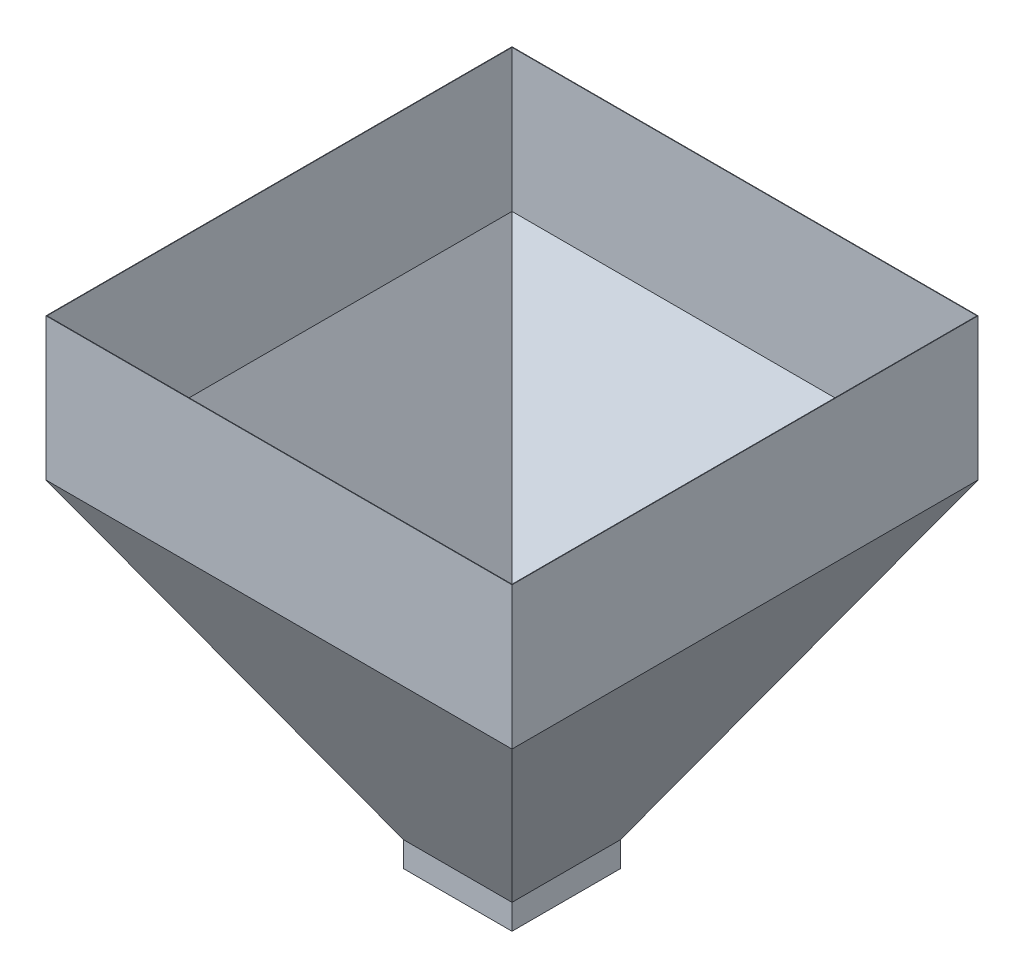
from build123d import *

# Parameters (mm, degrees)
CROQUIS3_W              = 688
CROQUIS3_H              = 688
SALIENTE_EXTRUIR1_DEPTH = 210
VACIADO2_T              = -0.76
CROQUIS4_W              = 160
CROQUIS4_H              = 160
CROQUIS4_W_2            = 158.247461632
CROQUIS4_H_2            = 158.247461632
SALIENTE_EXTRUIR2_DEPTH = 37


with BuildPart() as part:
    # Croquis1 → Recubrir1 section 0
    with BuildSketch(Plane(origin=(0, 0, 0), x_dir=(1, 0, 0), z_dir=(0, 1, 0))):
        with BuildLine():
            Line((-344, 344), (344, 344))
            Line((344, 344), (344, -344))
            Line((344, -344), (-344, -344))
            Line((-344, -344), (-344, 344))
        make_face()
    # Croquis2 → Recubrir1 section 1
    with BuildSketch(Plane(origin=(0, -460, 0), x_dir=(1, 0, 0), z_dir=(0, 1, 0))):
        with BuildLine():
            Line((-80, 80), (80, 80))
            Line((80, 80), (80, -80))
            Line((80, -80), (-80, -80))
            Line((-80, -80), (-80, 80))
        make_face()
    loft()

    # Croquis3 → Saliente-Extruir1 (add)
    with BuildSketch(Plane(origin=(0, 0, 0), x_dir=(1, 0, 0), z_dir=(0, 1, 0))):
        Rectangle(CROQUIS3_W, CROQUIS3_H)
    extrude(amount=SALIENTE_EXTRUIR1_DEPTH)

    # Vaciado2
    vaciado2_openings = [part.faces().sort_by_distance(p)[0] for p in [
        (0, -460, 0),
        (0, 210, 0),
    ]]
    offset(amount=VACIADO2_T, openings=vaciado2_openings, kind=Kind.INTERSECTION)

    # Croquis4 → Saliente-Extruir2 (add)
    with BuildSketch(Plane.XZ.offset(460)):
        Rectangle(CROQUIS4_W, CROQUIS4_H)
        Rectangle(CROQUIS4_W_2, CROQUIS4_H_2, mode=Mode.SUBTRACT)
    extrude(amount=SALIENTE_EXTRUIR2_DEPTH)


solid = part.part
